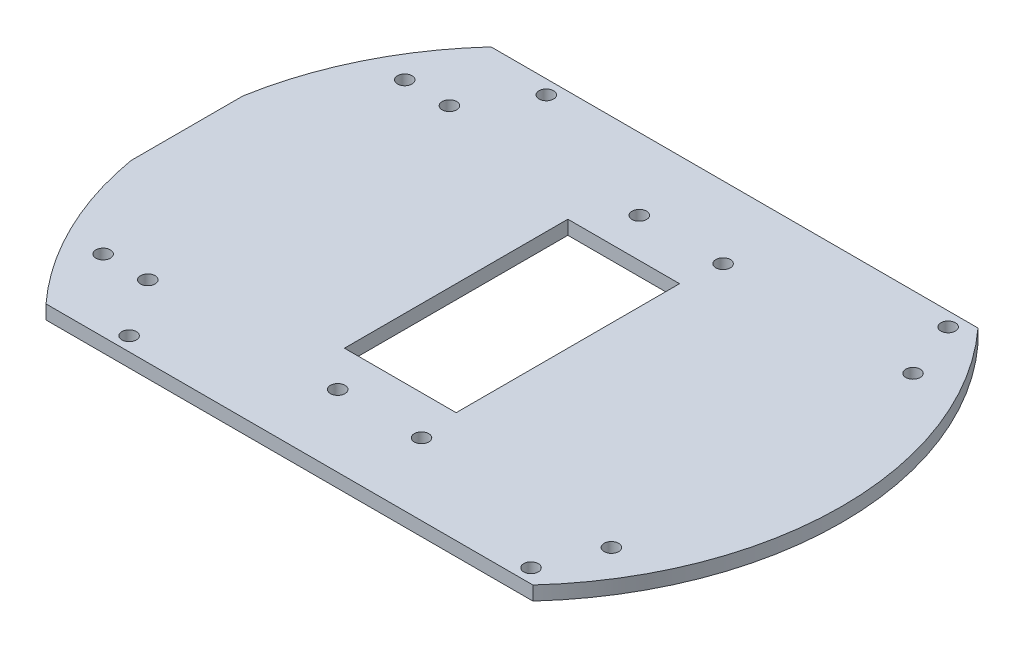
from build123d import *

# Parameters (mm, degrees)
SKETCH1_R           = 1.651
SKETCH1_W           = 25.4
SKETCH1_H           = 50.8
BOSS_EXTRUDE1_DEPTH = 3.175


with BuildPart() as part:
    # Sketch1 → Boss-Extrude1 (new body)
    with BuildSketch(Plane(origin=(0, 0, 0), x_dir=(1, 0, 0), z_dir=(0, 1, 0))):
        with BuildLine():
            Line((-73.916912814, 12.7), (-73.916912814, -12.7))
            ThreePointArc((-73.916912814, -12.7), (-67.357563081, -32.984218889), (-55.35602635, -50.603461806))
            Line((-55.35602635, -50.603461806), (55.35602635, -50.603461806))
            ThreePointArc((55.35602635, -50.603461806), (75, 0), (55.35602635, 50.603461806))
            Line((55.35602635, 50.603461806), (-55.35602635, 50.603461806))
            ThreePointArc((-55.35602635, 50.603461806), (-67.357563081, 32.984218889), (-73.916912814, 12.7))
        make_face()
        with Locations(Location((13.713087186, 34.29, 0), (0, 0, 270))):
            Circle(SKETCH1_R, mode=Mode.SUBTRACT)
        with Locations(Location((-58.676912814, -34.29, 0), (0, 0, 270))):
            Circle(SKETCH1_R, mode=Mode.SUBTRACT)
        with Locations(Location((-58.676912814, 34.29, 0), (0, 0, 270))):
            Circle(SKETCH1_R, mode=Mode.SUBTRACT)
        with Locations(Location((-39.626912814, 47.428461806, 0), (0, 0, 270))):
            Circle(SKETCH1_R, mode=Mode.SUBTRACT)
        with Locations(Location((51.749406285, 47.428461806, 0), (0, 0, 270))):
            Circle(SKETCH1_R, mode=Mode.SUBTRACT)
        with Locations(Location((-39.626912814, -47.428461806, 0), (0, 0, 270))):
            Circle(SKETCH1_R, mode=Mode.SUBTRACT)
        with Locations(Location((51.749406285, -47.428461806, 0), (0, 0, 270))):
            Circle(SKETCH1_R, mode=Mode.SUBTRACT)
        with Locations(Location((56.893087186, 34.29, 0), (0, 0, 270))):
            Circle(SKETCH1_R, mode=Mode.SUBTRACT)
        with Locations(Location((-48.516912814, 34.29, 0), (0, 0, 270))):
            Circle(SKETCH1_R, mode=Mode.SUBTRACT)
        with Locations(Location((-5.336912814, 34.29, 0), (0, 0, 270))):
            Circle(SKETCH1_R, mode=Mode.SUBTRACT)
        with Locations(Location((-5.336912814, -34.29, 0), (0, 0, 270))):
            Circle(SKETCH1_R, mode=Mode.SUBTRACT)
        with Locations(Location((-48.516912814, -34.29, 0), (0, 0, 270))):
            Circle(SKETCH1_R, mode=Mode.SUBTRACT)
        with Locations(Location((13.713087186, -34.29, 0), (0, 0, 270))):
            Circle(SKETCH1_R, mode=Mode.SUBTRACT)
        with Locations(Location((56.893087186, -34.29, 0), (0, 0, 270))):
            Circle(SKETCH1_R, mode=Mode.SUBTRACT)
        Rectangle(SKETCH1_W, SKETCH1_H, mode=Mode.SUBTRACT)
    extrude(amount=BOSS_EXTRUDE1_DEPTH)


solid = part.part
